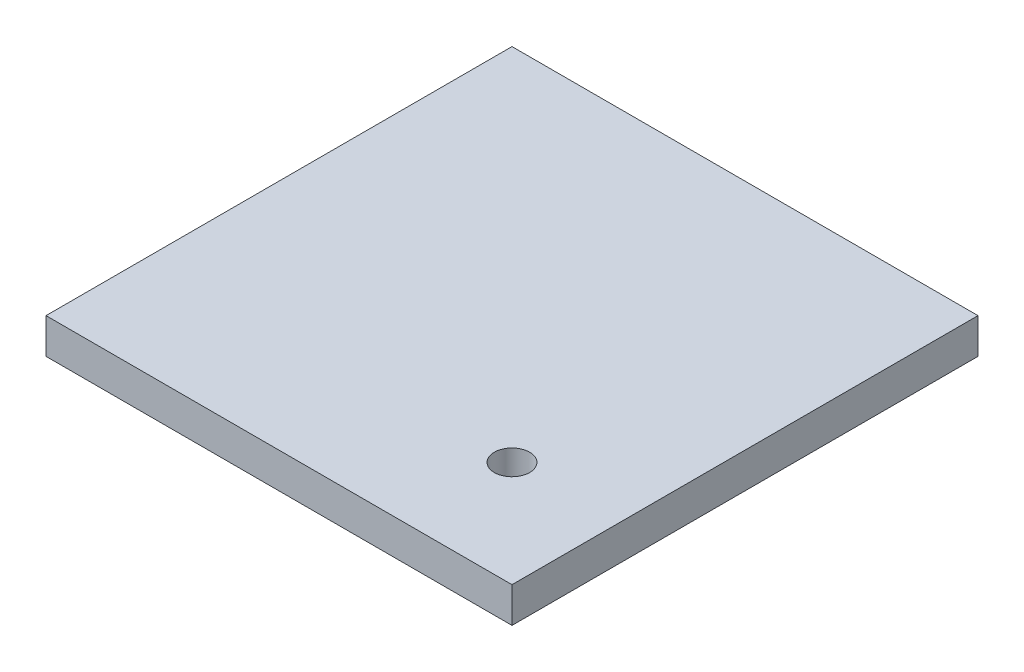
from build123d import *

# Parameters (mm, degrees)
IZIM1_W                     = 66
IZIM1_H                     = 66
IZIM1_R                     = 2.5
Y_KSEKLIK_EKSTR_ZYON1_DEPTH = 5


with BuildPart() as part:
    # Çizim1 → Yükseklik-Ekstrüzyon1 (new body)
    with BuildSketch(Plane(origin=(0, 0, 0), x_dir=(1, 0, 0), z_dir=(0, 1, 0))):
        with Locations((33, 33)):
            Rectangle(IZIM1_W, IZIM1_H)
        with Locations(Location((51, 15, 0), (0, 0, 270))):
            Circle(IZIM1_R, mode=Mode.SUBTRACT)
    extrude(amount=Y_KSEKLIK_EKSTR_ZYON1_DEPTH)


solid = part.part
